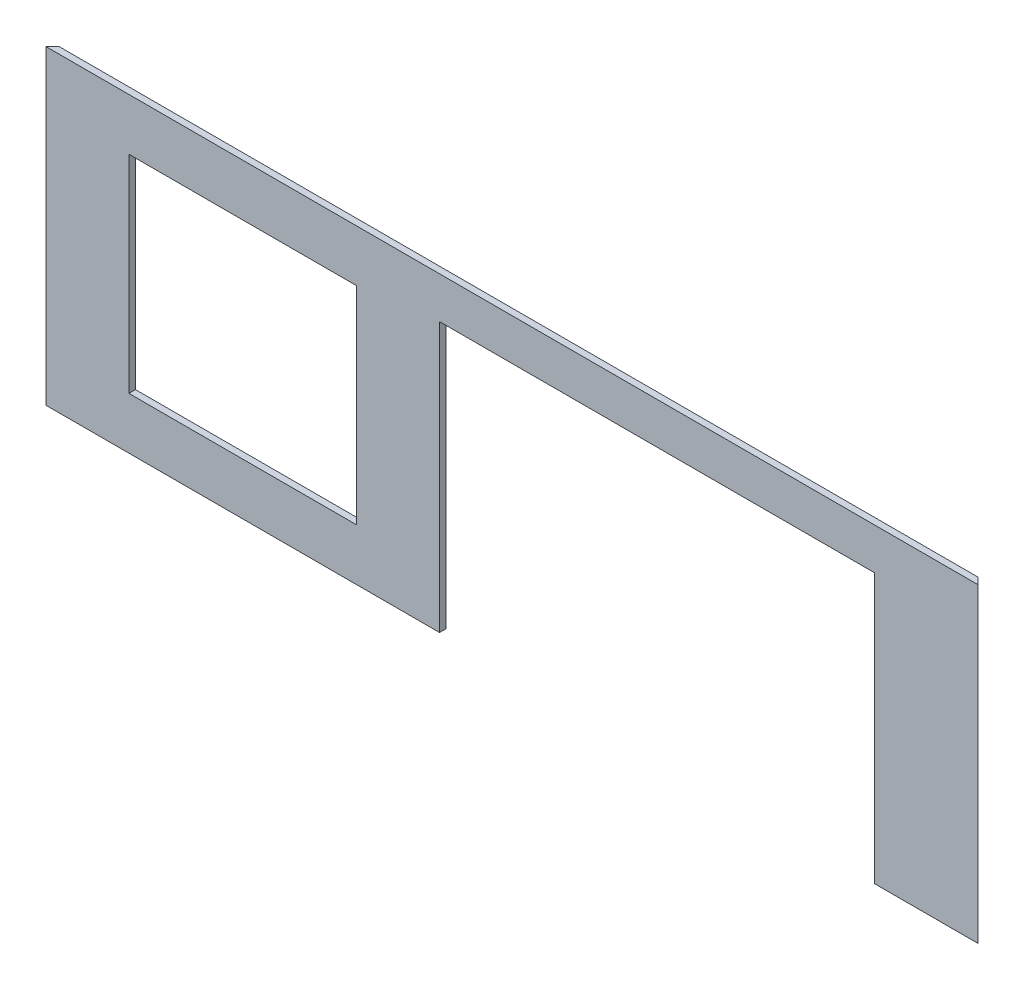
from build123d import *

# Parameters (mm, degrees)
SKETCH1_W           = 450
SKETCH1_H           = 150
BOSS_EXTRUDE1_DEPTH = 3.175
CUT_EXTRUDE1_DEPTH  = 475.352274818
SKETCH3_W           = 210
SKETCH3_H           = 130
SKETCH3_W_2         = 110
SKETCH3_H_2         = 100
CUT_EXTRUDE2_DEPTH  = 475.352274818


with BuildPart() as part:
    # Sketch1 → Boss-Extrude1 (new body)
    with BuildSketch(Plane.XY):
        with Locations((225, 75)):
            Rectangle(SKETCH1_W, SKETCH1_H)
    extrude(amount=BOSS_EXTRUDE1_DEPTH)

    # Sketch2 → Cut-Extrude1 (cut, through all)
    with BuildSketch(Plane(origin=(0, 150, 0), x_dir=(1, 0, 0), z_dir=(0, 1, 0))):
        Polygon((0, -3.175), (3.175, 0), (0, 0), align=None)
        Polygon((450, -3.175), (446.825, 0), (450, 0), align=None)
    extrude(amount=-CUT_EXTRUDE1_DEPTH, mode=Mode.SUBTRACT)

    # Sketch3 → Cut-Extrude2 (cut, through all)
    with BuildSketch(Plane.XY.offset(3.175)):
        with Locations((295, 65)):
            Rectangle(SKETCH3_W, SKETCH3_H)
        with Locations((95, 75)):
            Rectangle(SKETCH3_W_2, SKETCH3_H_2)
    extrude(amount=-CUT_EXTRUDE2_DEPTH, mode=Mode.SUBTRACT)


solid = part.part
